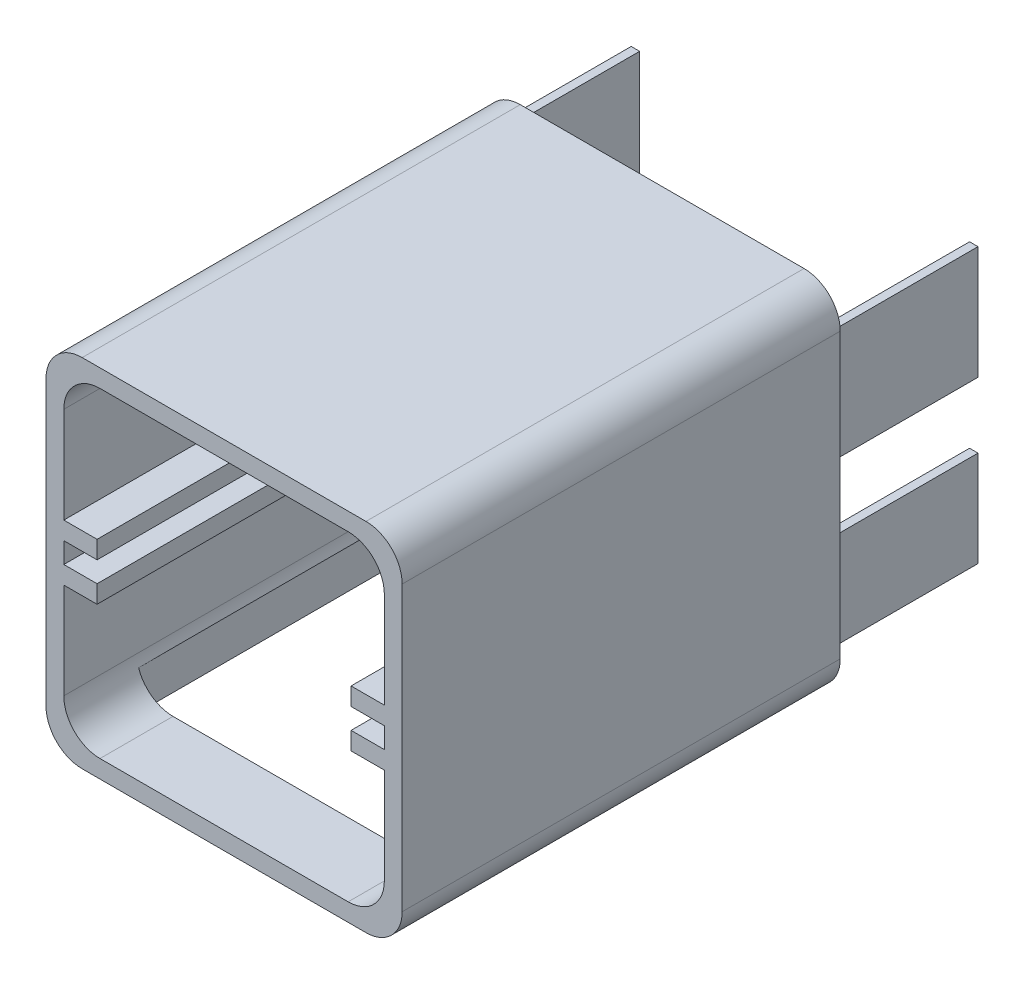
from build123d import *

# Parameters (mm, degrees)
SKETCH1_W                = 100
SKETCH1_H                = 100
BOSS_EXTRUDE1_DEPTH      = 250
SKETCH2_W                = 90
SKETCH2_H                = 90
CUT_EXTRUDE1_DEPTH       = 288.228132327
FILLET1_R                = 10.16
SKETCH3_W                = 9.3412
SKETCH3_H                = 5
BOSS_EXTRUDE2_DEPTH      = 250
SKETCH4_W                = 100
SKETCH4_H                = 125
CUT_EXTRUDE2_DEPTH       = 288.228132327
SKETCH6_W                = 81
SKETCH6_H                = 100
CUT_EXTRUDE4_DEPTH       = 5
FILLET3_R                = 10.16
BOSS_EXTRUDE3_DEPTH      = 30.48
SKETCH9_W                = 81
SKETCH9_H                = 6.25
BOSS_EXTRUDE5_DEPTH      = 35.052
CUT_EXTRUDE5_DEPTH       = 2
SKETCH12_W               = 81
SKETCH12_H               = 2.848
CUT_EXTRUDE6_DEPTH       = 24.23
SKETCH13_W               = 2.5
SKETCH13_H               = 31.9
SKETCH13_H_2             = 27
BOSS_EXTRUDE6_DEPTH      = 40
SKETCH14_W               = 2.63
SKETCH14_H               = 32.03
SKETCH14_W_2             = 2.37
SKETCH14_H_2             = 31.77
SKETCH14_H_3             = 27.13
SKETCH14_H_4             = 26.87
CUT_EXTRUDE10_DEPTH      = 40
CUT_EXTRUDE11_DEPTH      = 6.25
CUT_EXTRUDE12_DEPTH      = 173.497863465
CUT_EXTRUDE12_DEPTH_BACK = 173.497863465
BOSS_EXTRUDE7_DEPTH      = 24.23
CUT_EXTRUDE14_REACH      = 287.489
SKETCH20_W               = 89
SKETCH20_H               = 102.5


with BuildPart() as part:
    # Sketch1 → Boss-Extrude1 (new body)
    with BuildSketch(Plane.XY):
        with Locations((50, 50)):
            Rectangle(SKETCH1_W, SKETCH1_H)
    extrude(amount=BOSS_EXTRUDE1_DEPTH)

    # Sketch2 → Cut-Extrude1 (cut, through all)
    with BuildSketch(Plane(origin=(0, 0, 0), x_dir=(-1, 0, 0), z_dir=(0, 0, -1))):
        with Locations((-50, 50)):
            Rectangle(SKETCH2_W, SKETCH2_H)
    extrude(amount=-CUT_EXTRUDE1_DEPTH, mode=Mode.SUBTRACT)

    # Fillet1
    fillet1_edges = [part.edges().sort_by_distance(p)[0] for p in [
        (0, 100, 125),
        (0, 0, 125),
        (100, 0, 125),
        (100, 100, 125),
    ]]
    fillet(fillet1_edges, radius=FILLET1_R)

    # Sketch3 → Boss-Extrude2 (add, through all)
    with BuildSketch(Plane(origin=(0, 0, 0), x_dir=(-1, 0, 0), z_dir=(0, 0, -1))):
        with Locations((-90.3294, 55.4)):
            Rectangle(SKETCH3_W, SKETCH3_H)
        with Locations((-90.3294, 44.6)):
            Rectangle(SKETCH3_W, SKETCH3_H)
        with Locations((-9.6706, 44.6)):
            Rectangle(SKETCH3_W, SKETCH3_H)
        with Locations((-9.6706, 55.4)):
            Rectangle(SKETCH3_W, SKETCH3_H)
    extrude(amount=-BOSS_EXTRUDE2_DEPTH)

    # Sketch4 → Cut-Extrude2 (cut, through all)
    with BuildSketch(Plane(origin=(0, 100, 0), x_dir=(1, 0, 0), z_dir=(0, 1, 0))):
        with Locations((50, -62.5)):
            Rectangle(SKETCH4_W, SKETCH4_H)
    extrude(amount=-CUT_EXTRUDE2_DEPTH, mode=Mode.SUBTRACT)

    # Sketch6 → Cut-Extrude4 (cut)
    with BuildSketch(Plane.XZ):
        with Locations((50, 175)):
            Rectangle(SKETCH6_W, SKETCH6_H)
    extrude(amount=-CUT_EXTRUDE4_DEPTH, mode=Mode.SUBTRACT)

    # Fillet3
    fillet3_edges = [part.edges().sort_by_distance(p)[0] for p in [
        (5, 95, 187.5),
        (5, 5, 187.5),
        (95, 95, 187.5),
        (95, 5, 187.5),
    ]]
    fillet(fillet3_edges, radius=FILLET3_R)

    # Sketch7 → Boss-Extrude3 (add)
    with BuildSketch(Plane(origin=(0, 0, 125), x_dir=(-1, 0, 0), z_dir=(0, 0, -1))):
        Polygon((-95, 96), (-5, 96), (-5, 57.9), (-9.5, 57.9), (-9.5, 92.952), (-90.5, 92.952), (-90.5, 57.9), (-95, 57.9), align=None)
    extrude(amount=-BOSS_EXTRUDE3_DEPTH)

    # Sketch9 → Boss-Extrude5 (add)
    with BuildSketch(Plane.XZ.offset(-92.952)):
        with Locations((50, 152.355)):
            Rectangle(SKETCH9_W, SKETCH9_H)
    extrude(amount=BOSS_EXTRUDE5_DEPTH)

    # Sketch10 → Cut-Extrude5 (cut)
    with BuildSketch(Plane.XY.offset(250)):
        with BuildLine():
            Line((89.84, 100), (10.16, 100))
            ThreePointArc((10.16, 100), (2.975795103, 97.024204897), (0, 89.84))
            Line((0, 89.84), (0, 10.16))
            ThreePointArc((0, 10.16), (2.975795103, 2.975795103), (10.16, 0))
            Line((10.16, 0), (89.84, 0))
            ThreePointArc((89.84, 0), (97.024204897, 2.975795103), (100, 10.16))
            Line((100, 10.16), (100, 89.84))
            ThreePointArc((100, 89.84), (97.024204897, 97.024204897), (89.84, 100))
        make_face()
    extrude(amount=-CUT_EXTRUDE5_DEPTH, mode=Mode.SUBTRACT)

    # Sketch12 → Cut-Extrude6 (cut)
    with BuildSketch(Plane(origin=(0, 0, 125), x_dir=(-1, 0, 0), z_dir=(0, 0, -1))):
        with Locations((-50, 94.376)):
            Rectangle(SKETCH12_W, SKETCH12_H)
    extrude(amount=-CUT_EXTRUDE6_DEPTH, mode=Mode.SUBTRACT)

    # Sketch13 → Boss-Extrude6 (add)
    with BuildSketch(Plane(origin=(0, 0, 125), x_dir=(-1, 0, 0), z_dir=(0, 0, -1))):
        with Locations((-97.5, 73.85)):
            Rectangle(SKETCH13_W, SKETCH13_H)
        with Locations((-97.5, 26.1)):
            Rectangle(SKETCH13_W, SKETCH13_H_2)
        with Locations((-2.5, 26.1)):
            Rectangle(SKETCH13_W, SKETCH13_H_2)
        with Locations((-2.5, 73.85)):
            Rectangle(SKETCH13_W, SKETCH13_H)
    extrude(amount=BOSS_EXTRUDE6_DEPTH)

    # Sketch14 → Cut-Extrude10 (cut)
    # profile 1 of 4: a face of its own
    with BuildSketch(Plane(origin=(0, 0, 125), x_dir=(-1, 0, 0), z_dir=(0, 0, -1))):
        with Locations((-97.5, 73.85)):
            Rectangle(SKETCH14_W, SKETCH14_H)
        with Locations((-97.5, 73.85)):
            Rectangle(SKETCH14_W_2, SKETCH14_H_2, mode=Mode.SUBTRACT)
    # profile 2 of 4: a face of its own
    with BuildSketch(Plane(origin=(0, 0, 125), x_dir=(-1, 0, 0), z_dir=(0, 0, -1))):
        with Locations((-2.5, 73.85)):
            Rectangle(SKETCH14_W, SKETCH14_H)
        with Locations((-2.5, 73.85)):
            Rectangle(SKETCH14_W_2, SKETCH14_H_2, mode=Mode.SUBTRACT)
    # profile 3 of 4: a face of its own
    with BuildSketch(Plane(origin=(0, 0, 125), x_dir=(-1, 0, 0), z_dir=(0, 0, -1))):
        with Locations((-97.5, 26.1)):
            Rectangle(SKETCH14_W, SKETCH14_H_3)
        with Locations((-97.5, 26.1)):
            Rectangle(SKETCH14_W_2, SKETCH14_H_4, mode=Mode.SUBTRACT)
    # profile 4 of 4: a face of its own
    with BuildSketch(Plane(origin=(0, 0, 125), x_dir=(-1, 0, 0), z_dir=(0, 0, -1))):
        with Locations((-2.5, 26.1)):
            Rectangle(SKETCH14_W, SKETCH14_H_3)
        with Locations((-2.5, 26.1)):
            Rectangle(SKETCH14_W_2, SKETCH14_H_4, mode=Mode.SUBTRACT)
    extrude(amount=CUT_EXTRUDE10_DEPTH, mode=Mode.SUBTRACT)

    # Sketch15 → Cut-Extrude11 (cut)
    with BuildSketch(Plane.XY.offset(155.48)):
        with BuildLine():
            Line((5, 57.9), (14.3412, 57.9))
            Line((14.3412, 57.9), (85.6588, 57.9))
            Line((85.6588, 57.9), (95, 57.9))
            Line((95, 57.9), (95, 84.84))
            ThreePointArc((95, 84.84), (92.024204897, 92.024204897), (84.84, 95))
            Line((84.84, 95), (15.16, 95))
            ThreePointArc((15.16, 95), (7.975795103, 92.024204897), (5, 84.84))
            Line((5, 84.84), (5, 57.9))
        make_face()
    extrude(amount=-CUT_EXTRUDE11_DEPTH, mode=Mode.SUBTRACT)

    # Sketch16 → Cut-Extrude12 (cut, two sides: drawn at the far end of the back side and taken through both)
    with BuildSketch(Plane.XY.offset(149.23).offset(-CUT_EXTRUDE12_DEPTH_BACK)):
        with BuildLine():
            Line((5, 57.9), (95, 57.9))
            Line((95, 57.9), (95, 84.84))
            ThreePointArc((95, 84.84), (92.024204897, 92.024204897), (84.84, 95))
            Line((84.84, 95), (15.16, 95))
            ThreePointArc((15.16, 95), (7.975795103, 92.024204897), (5, 84.84))
            Line((5, 84.84), (5, 57.9))
        make_face()
    extrude(amount=CUT_EXTRUDE12_DEPTH + CUT_EXTRUDE12_DEPTH_BACK, mode=Mode.SUBTRACT)

    # Sketch17 → Boss-Extrude7 (add)
    with BuildSketch(Plane(origin=(0, 0, 149.23), x_dir=(-1, 0, 0), z_dir=(0, 0, -1))):
        with BuildLine():
            Line((-84.84, 95), (-15.16, 95))
            ThreePointArc((-15.16, 95), (-12.201837845, 94.559818757), (-9.5, 93.277416666))
            Line((-9.5, 93.277416666), (-9.5, 95.8))
            Line((-9.5, 95.8), (-90.5, 95.8))
            Line((-90.5, 95.8), (-90.5, 93.277416666))
            ThreePointArc((-90.5, 93.277416666), (-87.798162155, 94.559818757), (-84.84, 95))
        make_face()
    extrude(amount=BOSS_EXTRUDE7_DEPTH)

    # Cut-Extrude14: up to this face of the body (flat: up to its plane)
    cut_extrude14_end = Plane(part.part.faces().sort_by_distance((9.6706, 42.1, 186.5))[0])
    # Sketch20 → Cut-Extrude14 (cut, up to the picked face)
    with BuildSketch(Plane.XZ, mode=Mode.PRIVATE) as cut_extrude14_sk1:
        with Locations((50, 176.25)):
            Rectangle(SKETCH20_W, SKETCH20_H)
    cut_extrude14_tool1 = split(extrude(cut_extrude14_sk1.sketch, amount=-CUT_EXTRUDE14_REACH, mode=Mode.PRIVATE), bisect_by=cut_extrude14_end, keep=Keep.BOTH, mode=Mode.PRIVATE)
    add(cut_extrude14_tool1.solids().sort_by(Axis((50, 0, 176.25), (0, 1, 0)))[0], mode=Mode.SUBTRACT)


solid = part.part
